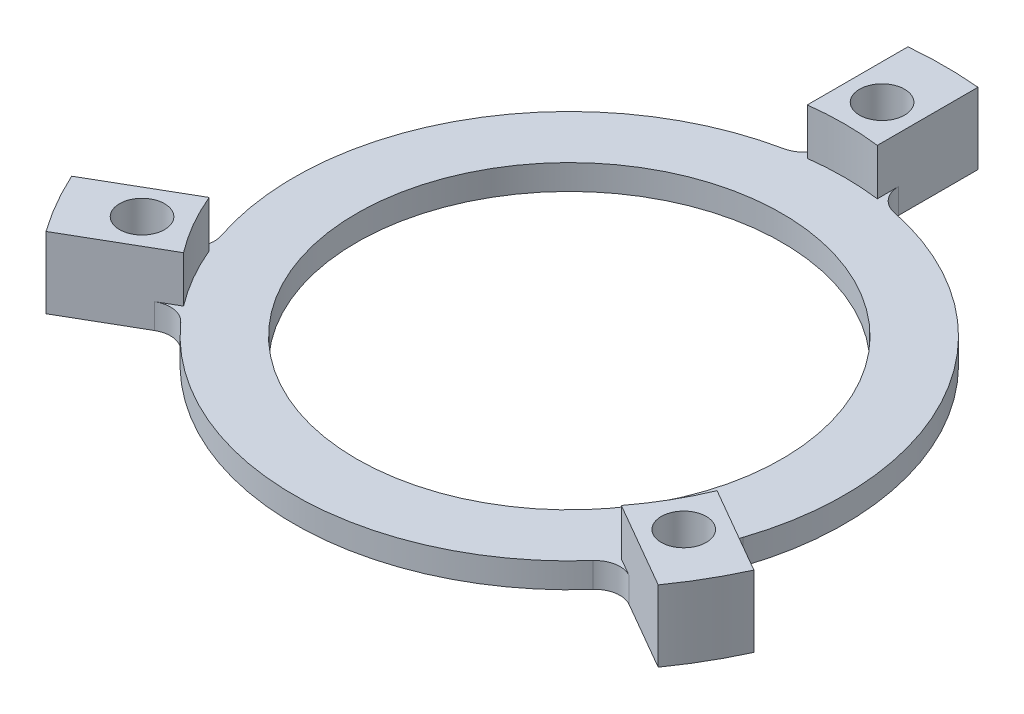
from build123d import *

# Parameters (mm, degrees)
SKETCH1_R             = 0.9
BOSS_EXTRUDE1_DEPTH   = 2.85
BOSS_EXTRUDE1_2_DEPTH = 2.85
BOSS_EXTRUDE1_3_DEPTH = 2.85
SKETCH1_3_R           = 8.5
BOSS_EXTRUDE2_DEPTH   = 1
FILLET1_R             = 1


with BuildPart() as part:
    # Sketch1 → Boss-Extrude1 (new body)
    with BuildSketch(Plane(origin=(0, 0, 0), x_dir=(1, 0, 0), z_dir=(0, 1, 0))):
        with BuildLine():
            ThreePointArc((-1.4, 10.910545358), (0, 11), (1.4, 10.910545358))
            Line((1.4, 10.910545358), (1.4, 14.934523762))
            ThreePointArc((1.4, 14.934523762), (0, 15), (-1.4, 14.934523762))
            Line((-1.4, 14.934523762), (-1.4, 10.910545358))
        make_face()
        with Locations((0, 12.5)):
            Circle(SKETCH1_R, mode=Mode.SUBTRACT)
    extrude(amount=BOSS_EXTRUDE1_DEPTH)



with BuildPart() as body_2:
    # Sketch1 → Boss-Extrude1 2 (new body)
    with BuildSketch(Plane(origin=(0, 0, 0), x_dir=(1, 0, 0), z_dir=(0, 1, 0))):
        with BuildLine():
            ThreePointArc((-8.748809449, -6.667708244), (-9.526279442, -5.5), (-10.148809449, -4.242837113))
            Line((-10.148809449, -4.242837113), (-13.633676971, -6.254826316))
            ThreePointArc((-13.633676971, -6.254826316), (-12.990381057, -7.5), (-12.233676971, -8.679697446))
            Line((-12.233676971, -8.679697446), (-8.748809449, -6.667708244))
        make_face()
        with Locations((-10.825317547, -6.25)):
            Circle(SKETCH1_R, mode=Mode.SUBTRACT)
    extrude(amount=BOSS_EXTRUDE1_2_DEPTH)


with BuildPart() as body_3:
    # Sketch1 → Boss-Extrude1 3 (new body)
    with BuildSketch(Plane(origin=(0, 0, 0), x_dir=(1, 0, 0), z_dir=(0, 1, 0))):
        with BuildLine():
            Line((13.633676971, -6.254826316), (10.148809449, -4.242837113))
            ThreePointArc((10.148809449, -4.242837113), (9.526279442, -5.5), (8.748809449, -6.667708244))
            Line((8.748809449, -6.667708244), (12.233676971, -8.679697446))
            ThreePointArc((12.233676971, -8.679697446), (12.990381057, -7.5), (13.633676971, -6.254826316))
        make_face()
        with Locations((10.825317547, -6.25)):
            Circle(SKETCH1_R, mode=Mode.SUBTRACT)
    extrude(amount=BOSS_EXTRUDE1_3_DEPTH)


with BuildPart() as part_1:
    add(part.part)

    add(body_2.part)  # Boss-Extrude2 merges body 2

    add(body_3.part)  # Boss-Extrude2 merges body 3
    # Sketch1<3> → Boss-Extrude2 (add)
    with BuildSketch(Plane(origin=(0, 0, 0), x_dir=(1, 0, 0), z_dir=(0, 1, 0))):
        with BuildLine():
            ThreePointArc((1.4, 10.910545358), (0, 11), (-1.4, 10.910545358))
            ThreePointArc((-1.4, 10.910545358), (-9.526279442, 5.5), (-10.148809449, -4.242837113))
            ThreePointArc((-10.148809449, -4.242837113), (-9.526279442, -5.5), (-8.748809449, -6.667708244))
            ThreePointArc((-8.748809449, -6.667708244), (0, -11), (8.748809449, -6.667708244))
            ThreePointArc((8.748809449, -6.667708244), (9.526279442, -5.5), (10.148809449, -4.242837113))
            ThreePointArc((10.148809449, -4.242837113), (10.785103243, -2.163688525), (11, 0))
            ThreePointArc((11, 0), (8.258329129, 7.26636085), (1.4, 10.910545358))
        make_face()
        Circle(SKETCH1_3_R, mode=Mode.SUBTRACT)
    extrude(amount=BOSS_EXTRUDE2_DEPTH)

    # Fillet1
    fillet1_edges = [part_1.edges().sort_by_distance(p)[0] for p in [
        (1.4, 0.5, -10.910545358),
        (10.148809449, 0.5, 4.242837113),
        (8.748809449, 0.5, 6.667708244),
        (-1.4, 0.5, -10.910545358),
        (-10.148809449, 0.5, 4.242837113),
        (-8.748809449, 0.5, 6.667708244),
    ]]
    fillet(fillet1_edges, radius=FILLET1_R)


solid = part_1.part
